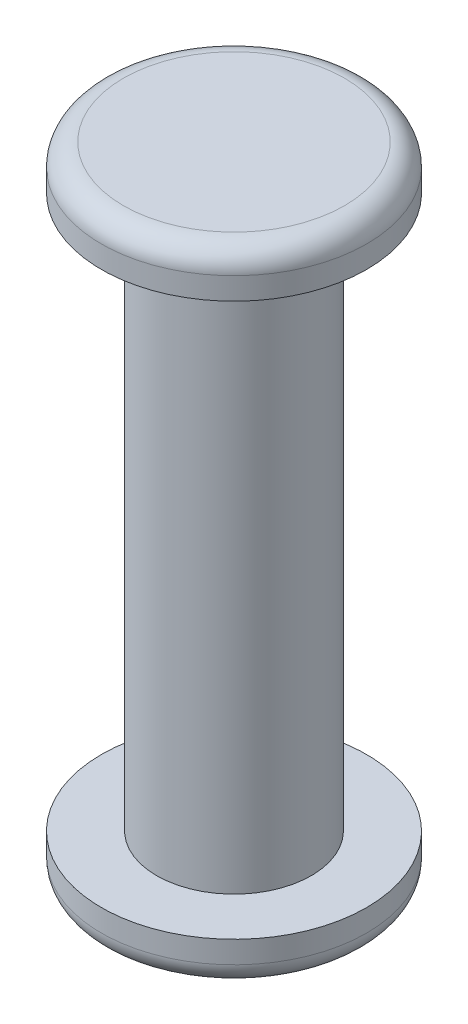
from build123d import *

# Parameters (mm, degrees)
SKETCH1_R           = 1.75
BOSS_EXTRUDE1_DEPTH = 12.5
SKETCH2_W           = 3
SKETCH2_H           = 1
FILLET1_R           = 0.5


with BuildPart() as part:
    # Sketch1 → Boss-Extrude1 (new body)
    with BuildSketch(Plane(origin=(0, 0, 0), x_dir=(1, 0, 0), z_dir=(0, 1, 0))):
        with Locations(Location((0, 0, 0), (0, 0, 270))):
            Circle(SKETCH1_R)
    extrude(amount=BOSS_EXTRUDE1_DEPTH)

    # Sketch2 → Revolve1 (revolve)
    with BuildSketch(Plane.XY, mode=Mode.PRIVATE) as revolve1_sk:
        with Locations((-1.5, 13)):
            Rectangle(SKETCH2_W, SKETCH2_H)
        with Locations((-1.5, -0.5)):
            Rectangle(SKETCH2_W, SKETCH2_H)
    revolve(revolve1_sk.sketch.rotate(Axis((0, 0, 0), (0, 1, 0)), 180), axis=Axis((0, 0, 0), (0, 1, 0)))

    # Fillet1
    fillet1_edges = [part.edges().sort_by_distance(p)[0] for p in [
        (-3, -1, 0),
        (-3, 13.5, 0),
    ]]
    fillet(fillet1_edges, radius=FILLET1_R)


solid = part.part
